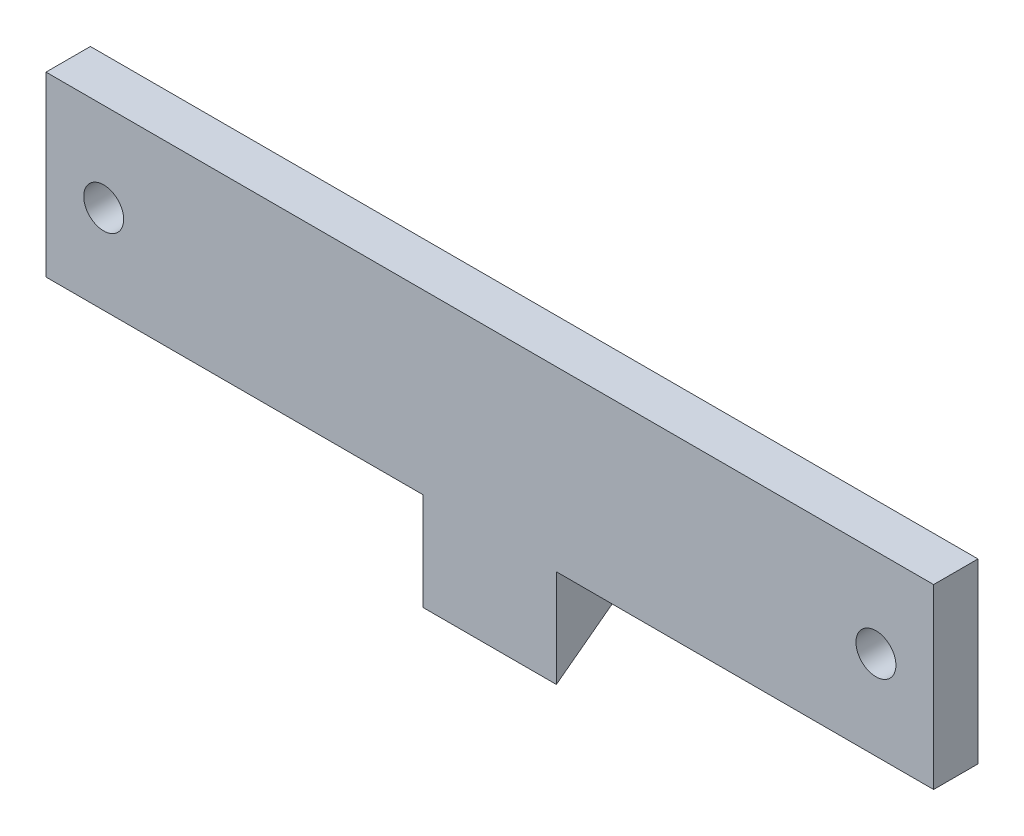
from build123d import *

# Parameters (mm, degrees)
SKETCH_1_W          = 100
SKETCH_1_H          = 20
EXTRUDE_1_DEPTH     = 5
HOLE_WIZARD_M4_1_D  = 4.5
SKETCH_4_W          = 15
SKETCH_4_H          = 5
EXTRUDE_2_DEPTH     = 5
SKETCH_5_W          = 15
SKETCH_5_H          = 5
EXTRUDE_3_DEPTH     = 7.35
SKETCH_6_W          = 15
SKETCH_6_H          = 8
EXTRUDE_4_DEPTH     = 6
CUT_EXTRUDE_1_DEPTH = 62.654460504


with BuildPart() as part:
    # 스케치1 → 보스-돌출1 (new body)
    with BuildSketch(Plane.XY):
        Rectangle(SKETCH_1_W, SKETCH_1_H)
    extrude(amount=EXTRUDE_1_DEPTH)

    # M4 여유 구멍1 (through all)
    with Locations(Plane.XY.offset(5)):
        with Locations((-43.5, 0), (43.5, 0)):
            Hole(HOLE_WIZARD_M4_1_D / 2)

    # 스케치4 → 보스-돌출2 (add)
    with BuildSketch(Plane(origin=(0, -10, 0), x_dir=(1, 0, 0), z_dir=(0, 1, 0))):
        with Locations((0, -2.5)):
            Rectangle(SKETCH_4_W, SKETCH_4_H)
    extrude(amount=-EXTRUDE_2_DEPTH)

    # 스케치5 → 보스-돌출3 (add)
    with BuildSketch(Plane.XY):
        with Locations((0, -12.5)):
            Rectangle(SKETCH_5_W, SKETCH_5_H)
    extrude(amount=-EXTRUDE_3_DEPTH)

    # 스케치6 → 보스-돌출4 (add)
    with BuildSketch(Plane.XZ.offset(15)):
        with Locations((0, 1)):
            Rectangle(SKETCH_6_W, SKETCH_6_H)
    extrude(amount=EXTRUDE_4_DEPTH)

    # 스케치7 → 컷-돌출1 (cut, through all)
    with BuildSketch(Plane(origin=(7.5, 0, 0), x_dir=(0, 0, -1), z_dir=(1, 0, 0))):
        Polygon((3, -21), (-5, -21), (3, -15), align=None)
    extrude(amount=-CUT_EXTRUDE_1_DEPTH, mode=Mode.SUBTRACT)


solid = part.part
